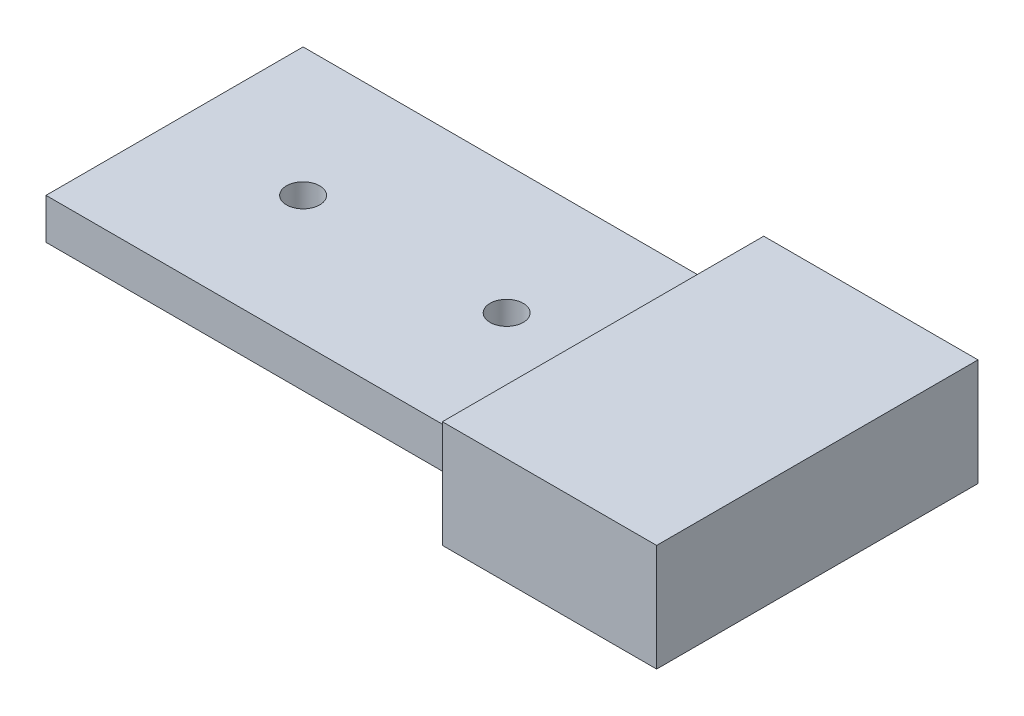
from build123d import *

# Parameters (mm, degrees)
SKETCH1_W           = 24
SKETCH1_H           = 3.8
BOSS_EXTRUDE1_DEPTH = 40
SKETCH2_R           = 1.55
CUT_EXTRUDE1_DEPTH  = 42.933757285
SKETCH3_W           = 30
SKETCH3_H           = 10
BOSS_EXTRUDE2_DEPTH = 20


with BuildPart() as part:
    # Sketch1 → Boss-Extrude1 (new body)
    with BuildSketch(Plane(origin=(0, 0, 0), x_dir=(0, 0, -1), z_dir=(1, 0, 0))):
        Rectangle(SKETCH1_W, SKETCH1_H)
    extrude(amount=BOSS_EXTRUDE1_DEPTH)

    # Sketch2 → Cut-Extrude1 (cut, through all)
    with BuildSketch(Plane.XZ.offset(1.9)):
        with Locations(Location((12, 0, 0), (0, 0, 270))):
            Circle(SKETCH2_R)
        with Locations(Location((31, 0, 0), (0, 0, 270))):
            Circle(SKETCH2_R)
    extrude(amount=-CUT_EXTRUDE1_DEPTH, mode=Mode.SUBTRACT)

    # Sketch3 → Boss-Extrude2 (add)
    with BuildSketch(Plane(origin=(40, 0, 0), x_dir=(0, 0, -1), z_dir=(1, 0, 0))):
        with Locations((0, 0.1)):
            Rectangle(SKETCH3_W, SKETCH3_H)
    extrude(amount=BOSS_EXTRUDE2_DEPTH)


solid = part.part
